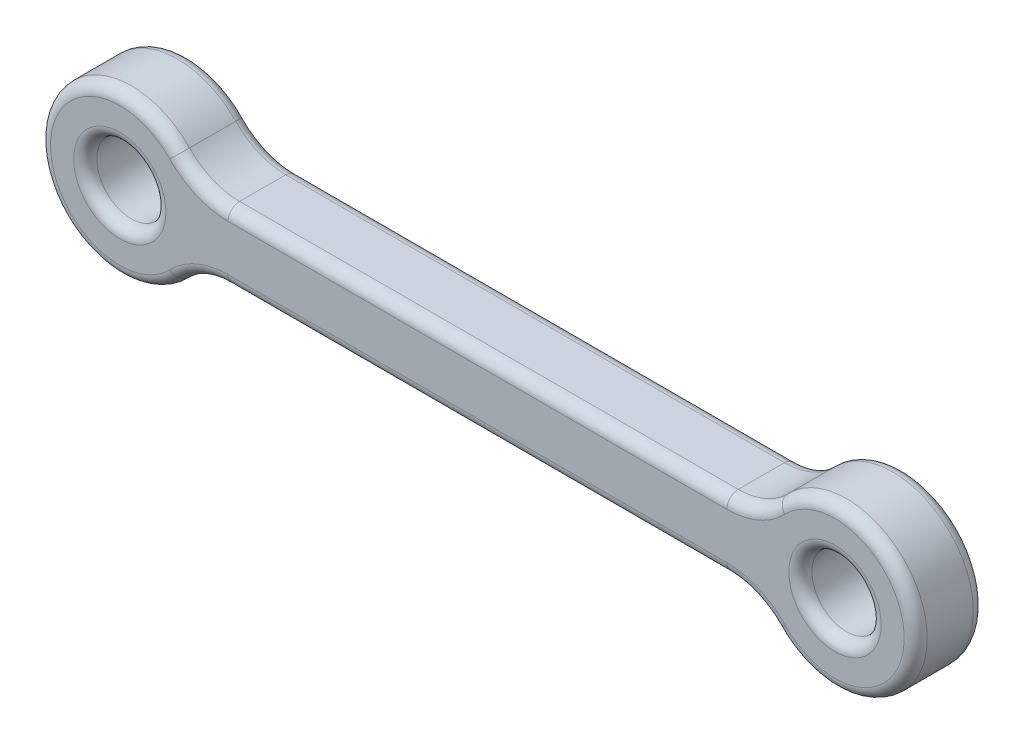
from build123d import *

# Parameters (mm, degrees)
SKETCH1_R           = 1.5
BOSS_EXTRUDE1_DEPTH = 3
FILLET1_R           = 0.5


with BuildPart() as part:
    # Sketch1 → Boss-Extrude1 (new body)
    with BuildSketch(Plane.XY):
        with BuildLine():
            Line((4.69041576, 1.5), (26.30958424, 1.5))
            ThreePointArc((26.30958424, 1.5), (27.486281051, 1.740401367), (28.474391514, 2.423076923))
            ThreePointArc((28.474391514, 2.423076923), (34.5, 0), (28.474391514, -2.423076923))
            ThreePointArc((28.474391514, -2.423076923), (27.486281051, -1.740401367), (26.30958424, -1.5))
            Line((26.30958424, -1.5), (4.69041576, -1.5))
            ThreePointArc((4.69041576, -1.5), (3.513718949, -1.740401367), (2.525608486, -2.423076923))
            ThreePointArc((2.525608486, -2.423076923), (-3.5, 0), (2.525608486, 2.423076923))
            ThreePointArc((2.525608486, 2.423076923), (3.513718949, 1.740401367), (4.69041576, 1.5))
        make_face()
        Circle(SKETCH1_R, mode=Mode.SUBTRACT)
        with Locations((31, 0)):
            Circle(SKETCH1_R, mode=Mode.SUBTRACT)
    extrude(amount=-BOSS_EXTRUDE1_DEPTH)

    # Fillet1
    fillet1_edges = [part.edges().sort_by_distance(p)[0] for p in [
        (-3.5, 0, 0),
        (3.513718949, 1.740401367, 0),
        (15.5, 1.5, 0),
        (27.486281051, 1.740401367, 0),
        (3.513718949, 1.740401367, -3),
        (-3.5, 0, -3),
        (3.513718949, -1.740401367, -3),
        (-1.5, 0, 0),
        (15.5, -1.5, -3),
        (29.5, 0, -3),
        (29.5, 0, 0),
        (27.486281051, -1.740401367, -3),
        (34.5, 0, -3),
        (27.486281051, 1.740401367, -3),
        (34.5, 0, 0),
        (15.5, 1.5, -3),
        (27.486281051, -1.740401367, 0),
        (15.5, -1.5, 0),
        (3.513718949, -1.740401367, 0),
    ]]
    fillet(fillet1_edges, radius=FILLET1_R)


solid = part.part
